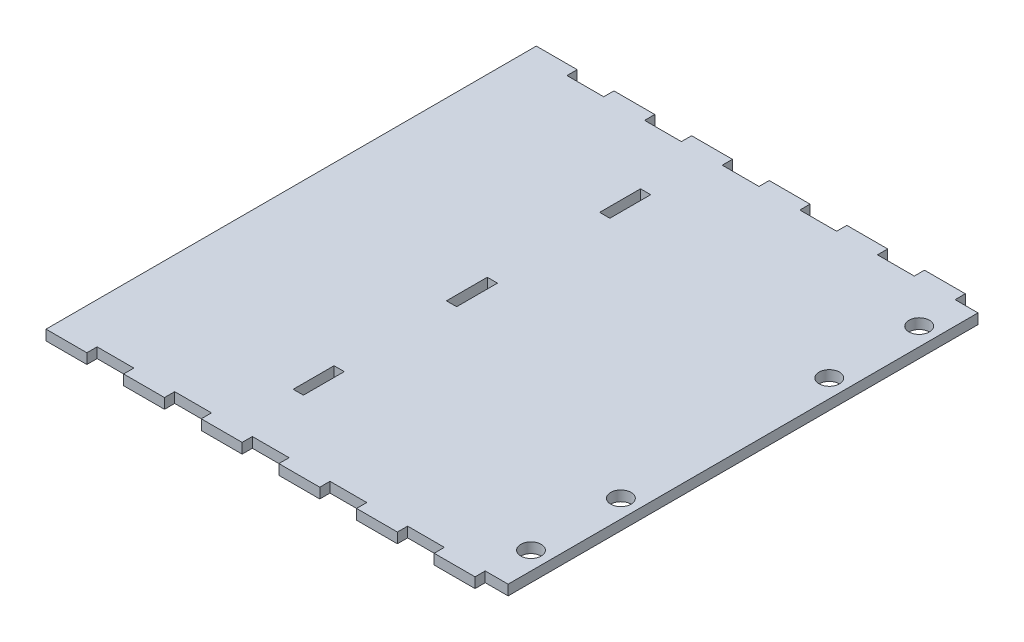
from build123d import *

# Parameters (mm, degrees)
BOSS_EXTRUDE1_DEPTH = 6.35
SKETCH2_R           = 6.35
SKETCH2_W           = 6.35
SKETCH2_H           = 25.4
CUT_EXTRUDE1_DEPTH  = 340.756694235


with BuildPart() as part:
    # Sketch1 → Boss-Extrude1 (new body)
    with BuildSketch(Plane(origin=(0, 0, 0), x_dir=(1, 0, 0), z_dir=(0, 1, 0))):
        Polygon((-97.696931278, -1.942339741), (-72.296931278, -1.942339741), (-72.296931278, -8.292339741), (-49.436931278, -8.292339741), (-49.436931278, -1.942339741), (-24.036931278, -1.942339741), (-24.036931278, -8.292339741), (-1.176931278, -8.292339741), (-1.176931278, -1.942339741), (24.223068722, -1.942339741), (24.223068722, -8.292339741), (47.083068722, -8.292339741), (47.083068722, -1.942339741), (72.483068722, -1.942339741), (72.483068722, -8.292339741), (95.343068722, -8.292339741), (95.343068722, -1.942339741), (120.743068722, -1.942339741), (120.743068722, -8.292339741), (134.967068722, -8.292339741), (134.967068722, -300.392339741), (120.743068722, -300.392339741), (120.743068722, -306.742339741), (95.343068722, -306.742339741), (95.343068722, -300.392339741), (72.483068722, -300.392339741), (72.483068722, -306.742339741), (47.083068722, -306.742339741), (47.083068722, -300.392339741), (24.223068722, -300.392339741), (24.223068722, -306.742339741), (-1.176931278, -306.742339741), (-1.176931278, -300.392339741), (-24.036931278, -300.392339741), (-24.036931278, -306.742339741), (-49.436931278, -306.742339741), (-49.436931278, -300.392339741), (-72.296931278, -300.392339741), (-72.296931278, -306.742339741), (-97.696931278, -306.742339741), (-97.696931278, -300.392339741), (-120.556931278, -300.392339741), (-120.556931278, -306.742339741), (-145.956931278, -306.742339741), (-145.956931278, -300.392339741), (-145.956931278, -8.292339741), (-145.956931278, -1.942339741), (-120.556931278, -1.942339741), (-120.556931278, -8.292339741), (-97.696931278, -8.292339741), align=None)
    extrude(amount=BOSS_EXTRUDE1_DEPTH)

    # Sketch2 → Cut-Extrude1 (cut, through all)
    with BuildSketch(Plane(origin=(0, 6.35, 0), x_dir=(1, 0, 0), z_dir=(0, 1, 0))):
        with Locations(Location((123.791068722, -274.992339741, 0), (0, 0, 270))):
            Circle(SKETCH2_R)
        with Locations(Location((123.791068722, -33.692339741, 0), (0, 0, 270))):
            Circle(SKETCH2_R)
        with Locations(Location((123.791068722, -89.572339741, 0), (0, 0, 270))):
            Circle(SKETCH2_R)
        with Locations(Location((123.791068722, -219.112339741, 0), (0, 0, 270))):
            Circle(SKETCH2_R)
        with Locations((-33.561931278, -59.092339741)):
            Rectangle(SKETCH2_W, SKETCH2_H)
        with Locations((-33.561931278, -249.592339741)):
            Rectangle(SKETCH2_W, SKETCH2_H)
        with Locations((-33.561931278, -154.342339741)):
            Rectangle(SKETCH2_W, SKETCH2_H)
    extrude(amount=-CUT_EXTRUDE1_DEPTH, mode=Mode.SUBTRACT)


solid = part.part
